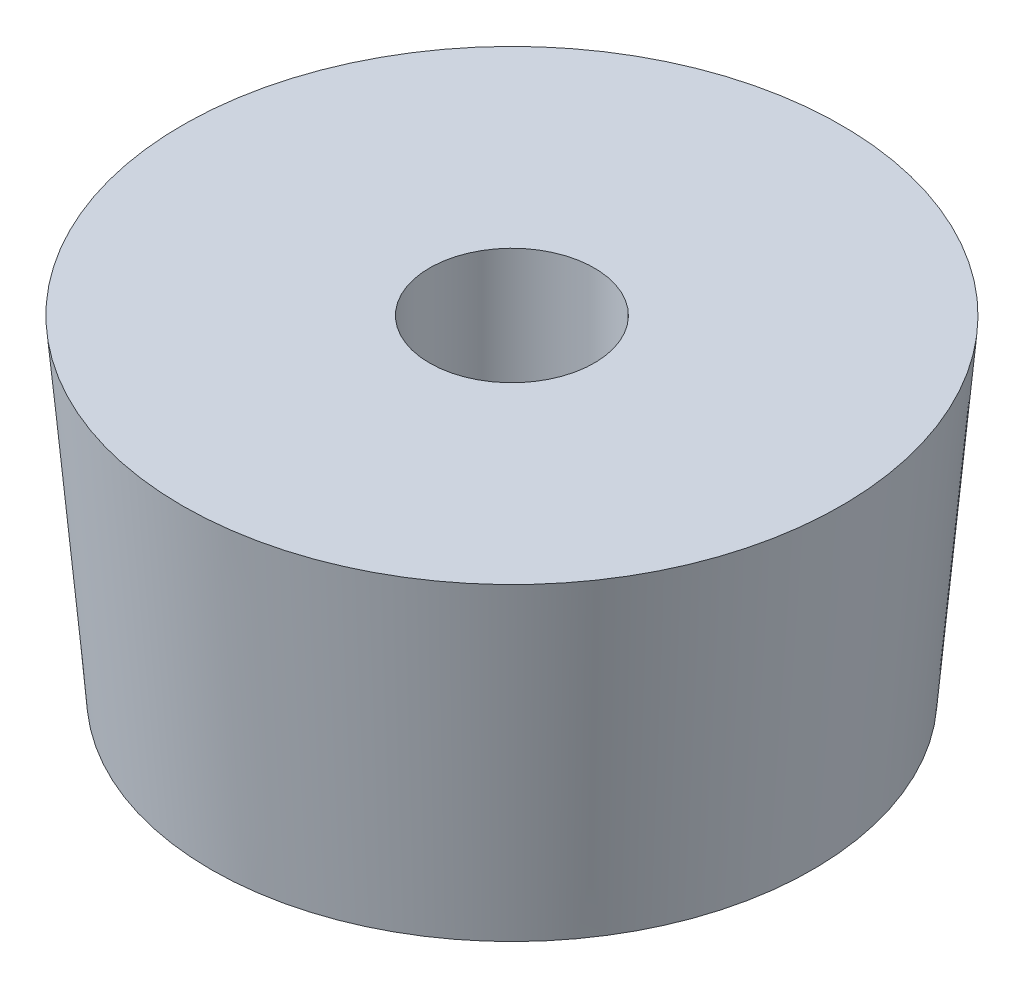
from build123d import *

# Parameters (mm, degrees)
SKETCH1_R           = 12.7
BOSS_EXTRUDE1_DEPTH = 12.7
BOSS_EXTRUDE1_DRAFT = -5
SKETCH2_R           = 3.175
CUT_EXTRUDE1_DEPTH  = 22.997045256
SKETCH7_R           = 1.27
CUT_EXTRUDE2_DEPTH  = 7.62


with BuildPart() as part:
    # Sketch1 → Boss-Extrude1 (with draft: the straight prism first)
    with BuildSketch(Plane(origin=(0, 0, 0), x_dir=(1, 0, 0), z_dir=(0, 1, 0))):
        Circle(SKETCH1_R)
    extrude(amount=-BOSS_EXTRUDE1_DEPTH)
    # Boss-Extrude1: the draft: its side faces are tilted about the plane it starts from
    boss_extrude1_sides = [part.faces().sort_by_distance(p)[0] for p in [
        (-12.7, -6.35, 0),
    ]]
    draft(boss_extrude1_sides, Plane(origin=(0, 0, 0), x_dir=(1, 0, 0), z_dir=(0, 1, 0)), BOSS_EXTRUDE1_DRAFT)

    # Sketch2 → Cut-Extrude1 (cut, through all)
    with BuildSketch(Plane(origin=(0, 0, 0), x_dir=(1, 0, 0), z_dir=(0, 1, 0))):
        with Locations(Location((0, 0, 0), (0, 0, 270))):
            Circle(SKETCH2_R)
    extrude(amount=-CUT_EXTRUDE1_DEPTH, mode=Mode.SUBTRACT)

    # Sketch7 → Cut-Extrude2 (cut)
    with BuildSketch(Plane.XZ.offset(12.7)):
        with Locations(Location((-8.636, 0, 0), (0, 0, 270))):
            Circle(SKETCH7_R)
        with Locations(Location((4.318, 7.478995387, 0), (0, 0, 270))):
            Circle(SKETCH7_R)
    extrude(amount=-CUT_EXTRUDE2_DEPTH, mode=Mode.SUBTRACT)


solid = part.part
